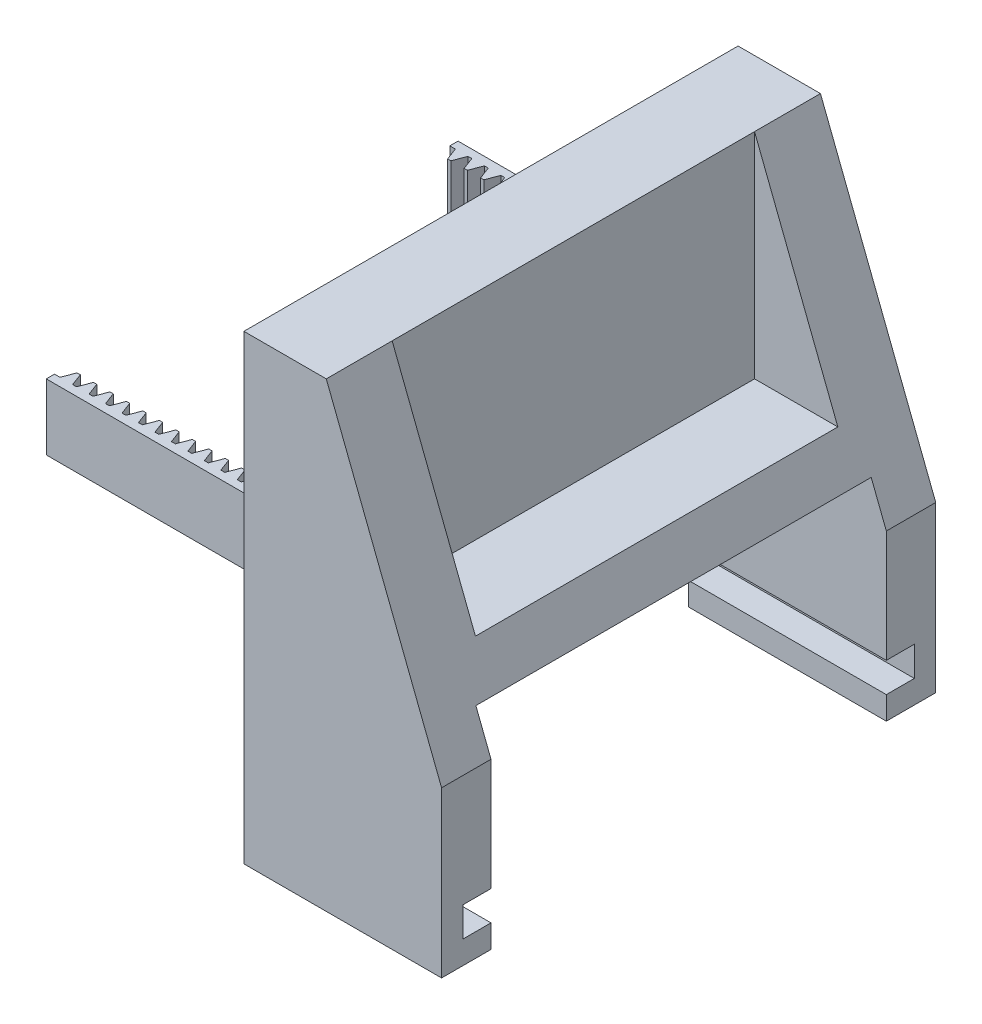
from build123d import *

# Parameters (mm, degrees)
BOSS_EXTRUDE1_DEPTH = 30
SKETCH4_W           = 24
SKETCH4_H           = 14
CUT_EXTRUDE2_DEPTH  = 25
SKETCH5_W           = 1.7
SKETCH5_H           = 1.8
CUT_EXTRUDE3_DEPTH  = 15
CUT_EXTRUDE4_DEPTH  = 11
BOSS_EXTRUDE2_DEPTH = 4


with BuildPart() as part:
    # Sketch1 → Boss-Extrude1 (new body)
    with BuildSketch(Plane.XY):
        Polygon((0, 0), (0, -28), (12, -28), (12, -18), (5, 0), align=None)
    extrude(amount=-BOSS_EXTRUDE1_DEPTH)

    # Sketch4 → Cut-Extrude2 (cut)
    with BuildSketch(Plane.ZY):
        with Locations((-15, -22.638599401)):
            Rectangle(SKETCH4_W, SKETCH4_H)
    extrude(amount=-CUT_EXTRUDE2_DEPTH, mode=Mode.SUBTRACT)

    # Sketch5 → Cut-Extrude3 (cut)
    with BuildSketch(Plane.ZY):
        with Locations((-2.15, -25.7)):
            Rectangle(SKETCH5_W, SKETCH5_H)
    cut_extrude3 = extrude(amount=-CUT_EXTRUDE3_DEPTH, mode=Mode.SUBTRACT)

    # Mirror1: Cut-Extrude3 across plane
    add(cut_extrude3.mirror(Plane.XY.offset(-15)), mode=Mode.SUBTRACT)

    # Sketch6 → Cut-Extrude4 (cut, symmetric)
    with BuildSketch(Plane.XY.offset(-15)):
        Polygon((5, 0), (5, -13), (10.055555556, -13), align=None)
    extrude(amount=CUT_EXTRUDE4_DEPTH, both=True, mode=Mode.SUBTRACT)

    # Sketch7 → Boss-Extrude2 (add)
    with BuildSketch(Plane(origin=(0, -15, 0), x_dir=(1, 0, 0), z_dir=(0, 1, 0))):
        Polygon((0, 27.5), (-14.5, 27.5), (-14.5, 27), (-14.164444468, 27), (-13.881153369, 26.251032188), (-13.681153369, 26.251032188), (-13.4, 27), (-13.164444468, 27), (-12.881153369, 26.251032188), (-12.681153369, 26.251032188), (-12.4, 27), (-12.164444468, 27), (-11.881153369, 26.251032188), (-11.681153369, 26.251032188), (-11.4, 27), (-11.164444468, 27), (-10.881153369, 26.251032188), (-10.681153369, 26.251032188), (-10.4, 27), (-10.164444468, 27), (-9.881153369, 26.251032188), (-9.681153369, 26.251032188), (-9.4, 27), (-9.164444468, 27), (-8.881153369, 26.251032188), (-8.681153369, 26.251032188), (-8.4, 27), (-8.164444468, 27), (-7.881153369, 26.251032188), (-7.681153369, 26.251032188), (-7.4, 27), (-7.164444468, 27), (-6.881153369, 26.251032188), (-6.681153369, 26.251032188), (-6.4, 27), (-6.164444468, 27), (-5.881153369, 26.251032188), (-5.681153369, 26.251032188), (-5.4, 27), (-5.164444468, 27), (-4.881153369, 26.251032188), (-4.681153369, 26.251032188), (-4.4, 27), (-4.164444468, 27), (-3.881153369, 26.251032188), (-3.681153369, 26.251032188), (-3.4, 27), (-3.164444468, 27), (-2.881153369, 26.251032188), (-2.681153369, 26.251032188), (-2.4, 27), (-2.164444468, 27), (-1.881153369, 26.251032188), (-1.681153369, 26.251032188), (-1.4, 27), (-1.164444468, 27), (-0.881153369, 26.251032188), (-0.681153369, 26.251032188), (-0.4, 27), (0, 27), align=None)
    boss_extrude2 = extrude(amount=BOSS_EXTRUDE2_DEPTH)

    # Mirror2: Boss-Extrude2 across plane
    add(boss_extrude2.mirror(Plane.XY.offset(-15)))


solid = part.part
